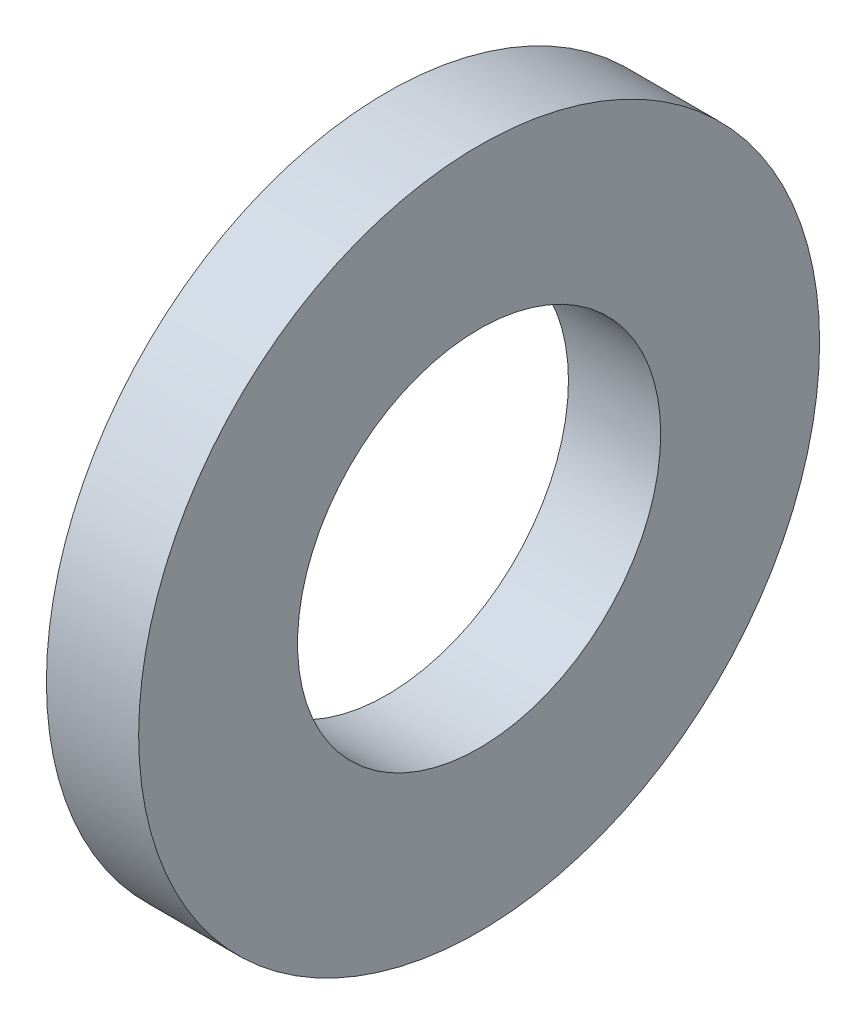
from build123d import *

# Parameters (mm, degrees)
SKETCH1_R           = 3
SKETCH1_R_2         = 1.6
BOSS_EXTRUDE1_DEPTH = 0.8128


with BuildPart() as part:
    # Sketch1 → Boss-Extrude1 (new body)
    with BuildSketch(Plane.YZ):
        with Locations(Location((0, 0, 0), (0, 0, 270))):
            Circle(SKETCH1_R)
        with Locations(Location((0, 0, 0), (0, 0, 270))):
            Circle(SKETCH1_R_2, mode=Mode.SUBTRACT)
    extrude(amount=BOSS_EXTRUDE1_DEPTH)


solid = part.part
